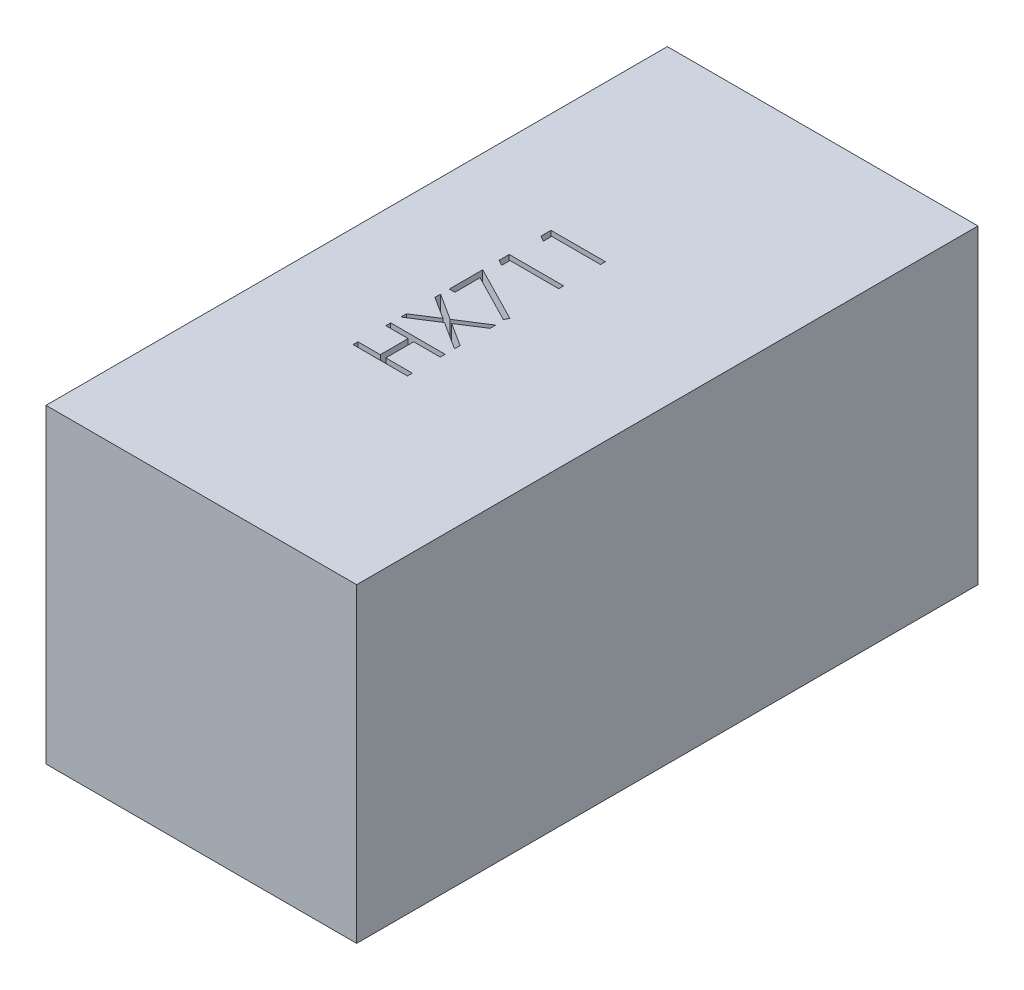
from build123d import *

# Parameters (mm, degrees)
SKETCH1_W           = 20
SKETCH1_H           = 40
BOSS_EXTRUDE1_DEPTH = 20
CUT_EXTRUDE1_DEPTH  = 2


with BuildPart() as part:
    # Sketch1 → Boss-Extrude1 (new body)
    with BuildSketch(Plane(origin=(0, 0, 0), x_dir=(1, 0, 0), z_dir=(0, 1, 0))):
        Rectangle(SKETCH1_W, SKETCH1_H)
    extrude(amount=BOSS_EXTRUDE1_DEPTH)

    # Sketch2 → Cut-Extrude1 (cut)
    with BuildSketch(Plane(origin=(0, 20, 0), x_dir=(1, 0, 0), z_dir=(0, 1, 0))):
        Polygon((-3.5, -6.730769231), (-3.5, -6.416666667), (-2.064102564, -6.416666667), (-2.064102564, -4.621794872), (-3.5, -4.621794872), (-3.5, -4.307692308), (0, -4.307692308), (0, -4.621794872), (-1.705128205, -4.621794872), (-1.705128205, -6.416666667), (0, -6.416666667), (0, -6.730769231), align=None)
        Polygon((-3.5, -3.657051282), (-3.5, -3.294571314), (-2.068309295, -2.378205128), (-3.5, -1.461838942), (-3.5, -1.099358974), (-1.78505609, -2.196614583), (0, -1.054487179), (0, -1.416967147), (-1.501802885, -2.378205128), (0, -3.339443109), (0, -3.701923077), (-1.78505609, -2.559094551), align=None)
        Polygon((-3.5, -0.538461538), (-3.5, 1.615384615), (0.08974359, -0.224358974), (-0.059595353, -0.495693109), (-3.141025641, 1.083934295), (-3.141025641, -0.538461538), align=None)
        Polygon((-3.5, 2.673377404), (-3.5, 3.320512821), (0, 3.320512821), (0, 3.006410256), (-3.141025641, 3.006410256), (-3.141025641, 2.467948718), align=None)
        Polygon((-3.5, 5.365685096), (-3.5, 6.012820513), (0, 6.012820513), (0, 5.698717949), (-3.141025641, 5.698717949), (-3.141025641, 5.16025641), align=None)
    extrude(amount=-CUT_EXTRUDE1_DEPTH, mode=Mode.SUBTRACT)


solid = part.part
